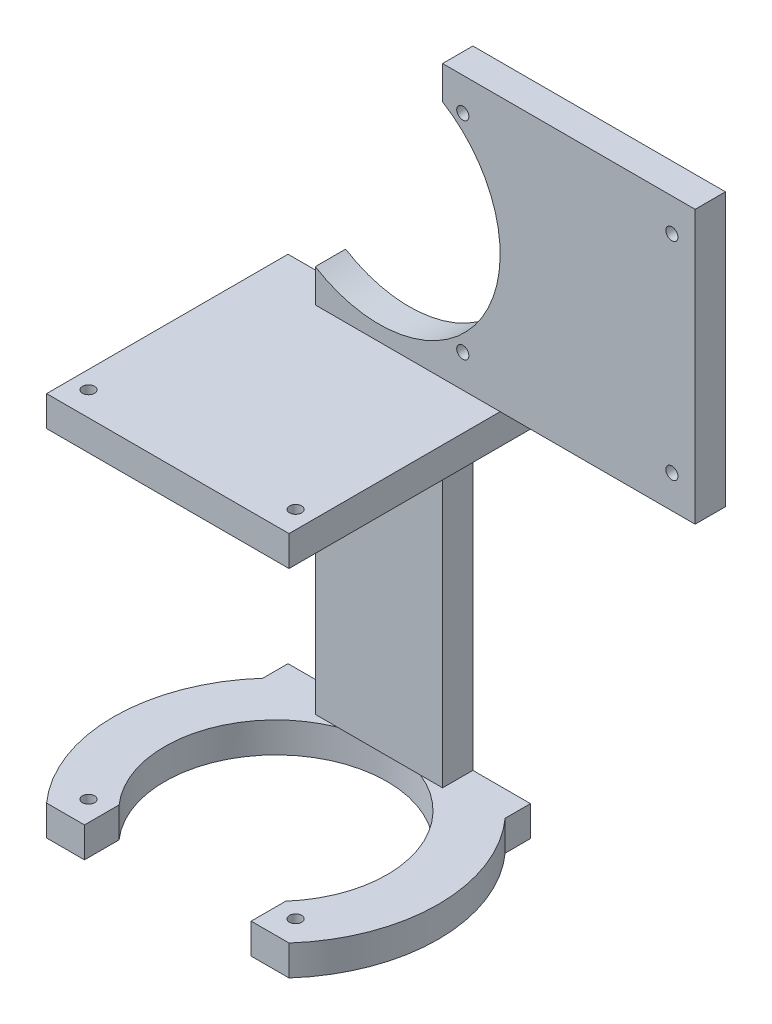
from build123d import *

# Parameters (mm, degrees)
SKETCH_1_W                      = 25
SKETCH_1_H                      = 27
EXTRUDE_1_DEPTH                 = 3
CUT_EXTRUDE_1_REACH             = 38.919
SKETCH_2_R                      = 0.6
SKETCH_2_R_2                    = 12
CUT_EXTRUDE_1_DIRECTION_2_DEPTH = 37.918829884
EXTRUDE_2_DEPTH                 = 3
SKETCH_4_W                      = 24
SKETCH_4_H                      = 3
EXTRUDE_3_DEPTH                 = 20.9
EXTRUDE_3_DIRECTION_2_REACH     = 47.668
CUT_EXTRUDE_2_REACH             = 53.457
SKETCH_5_R                      = 0.6
CUT_EXTRUDE_2_DIRECTION_2_DEPTH = 52.456972317
CUT_EXTRUDE_4_DEPTH             = 3
EXTRUDE_4_DEPTH                 = 3


with BuildPart() as part:
    # 草图1 → 凸台-拉伸1 (new body)
    with BuildSketch(Plane.XY):
        with Locations((12.5, 13.5)):
            Rectangle(SKETCH_1_W, SKETCH_1_H)
    extrude(amount=EXTRUDE_1_DEPTH)

    # 草图2 → 切除-拉伸1 (cut, up to next)
    with BuildSketch(Plane.XY.offset(3), mode=Mode.PRIVATE) as cut_extrude_1_sk1:
        with Locations(Location((2, 23.75, 0), (0, 0, 180))):
            Circle(SKETCH_2_R)
    cut_extrude_1_tool1 = extrude(cut_extrude_1_sk1.sketch, amount=-CUT_EXTRUDE_1_REACH, mode=Mode.PRIVATE) & part.part
    # 草图2 → 切除-拉伸1 (cut, up to next)
    with BuildSketch(Plane.XY.offset(3), mode=Mode.PRIVATE) as cut_extrude_1_sk2:
        with Locations(Location((22.7, 23.75, 0), (0, 0, 180))):
            Circle(SKETCH_2_R)
    cut_extrude_1_tool2 = extrude(cut_extrude_1_sk2.sketch, amount=-CUT_EXTRUDE_1_REACH, mode=Mode.PRIVATE) & part.part
    # 草图2 → 切除-拉伸1 (cut, up to next)
    with BuildSketch(Plane.XY.offset(3), mode=Mode.PRIVATE) as cut_extrude_1_sk3:
        with Locations(Location((22.7, 3.25, 0), (0, 0, 180))):
            Circle(SKETCH_2_R)
    cut_extrude_1_tool3 = extrude(cut_extrude_1_sk3.sketch, amount=-CUT_EXTRUDE_1_REACH, mode=Mode.PRIVATE) & part.part
    # 草图2 → 切除-拉伸1 (cut, up to next)
    with BuildSketch(Plane.XY.offset(3), mode=Mode.PRIVATE) as cut_extrude_1_sk4:
        with Locations(Location((2, 3.25, 0), (0, 0, 180))):
            Circle(SKETCH_2_R)
    cut_extrude_1_tool4 = extrude(cut_extrude_1_sk4.sketch, amount=-CUT_EXTRUDE_1_REACH, mode=Mode.PRIVATE) & part.part
    # 草图2 → 切除-拉伸1 (cut, up to next)
    with BuildSketch(Plane.XY.offset(3), mode=Mode.PRIVATE) as cut_extrude_1_sk5:
        with Locations((-6.3, 13.5)):
            Circle(SKETCH_2_R_2)
    cut_extrude_1_tool5 = extrude(cut_extrude_1_sk5.sketch, amount=-CUT_EXTRUDE_1_REACH, mode=Mode.PRIVATE) & part.part
    add(cut_extrude_1_tool1.solids().sort_by_distance((2, 23.75, 3))[0], mode=Mode.SUBTRACT)
    add(cut_extrude_1_tool2.solids().sort_by_distance((22.7, 23.75, 3))[0], mode=Mode.SUBTRACT)
    add(cut_extrude_1_tool3.solids().sort_by_distance((22.7, 3.25, 3))[0], mode=Mode.SUBTRACT)
    add(cut_extrude_1_tool4.solids().sort_by_distance((2, 3.25, 3))[0], mode=Mode.SUBTRACT)
    add(cut_extrude_1_tool5.solids().sort_by_distance((-6.3, 13.5, 3))[0], mode=Mode.SUBTRACT)

    # 草图2 → 切除-拉伸1 direction 2 (cut)
    with BuildSketch(Plane.XY.offset(3)):
        with Locations(Location((2, 23.75, 0), (0, 0, 180))):
            Circle(SKETCH_2_R)
        with Locations(Location((22.7, 23.75, 0), (0, 0, 180))):
            Circle(SKETCH_2_R)
        with Locations(Location((22.7, 3.25, 0), (0, 0, 180))):
            Circle(SKETCH_2_R)
        with Locations(Location((2, 3.25, 0), (0, 0, 180))):
            Circle(SKETCH_2_R)
        with Locations((-6.3, 13.5)):
            Circle(SKETCH_2_R_2)
    extrude(amount=CUT_EXTRUDE_1_DIRECTION_2_DEPTH, mode=Mode.SUBTRACT)

    # 草图3 → 凸台-拉伸2 (add)
    with BuildSketch(Plane.XY.offset(3)):
        with BuildLine():
            ThreePointArc((0, 3.286773282), (-3.025761204, 1.955331953), (-6.3, 1.5))
            Line((-6.3, 1.5), (-6.3, -38.1))
            Line((-6.3, -38.1), (0, -38.1))
            Line((0, -38.1), (0, 0))
            Line((0, 0), (0, 3.286773282))
        make_face()
        with BuildLine():
            Line((-6.3, -38.1), (-6.3, 1.5))
            ThreePointArc((-6.3, 1.5), (-9.574238796, 1.955331953), (-12.6, 3.286773282))
            Line((-12.6, 3.286773282), (-12.6, -38.1))
            Line((-12.6, -38.1), (-6.3, -38.1))
        make_face()
    extrude(amount=-EXTRUDE_2_DEPTH)

    # 草图4 → 凸台-拉伸3 (add)
    with BuildSketch(Plane.XY.offset(3)):
        with Locations((-6.3, -1.5)):
            Rectangle(SKETCH_4_W, SKETCH_4_H)
    extrude_3 = extrude(amount=EXTRUDE_3_DEPTH)

    # 凸台-拉伸3 direction 2: up to this face of the body (flat: up to its plane)
    extrude_3_direction_2_end = Plane(part.part.faces().sort_by_distance((6.451782548, 13.5, 0))[0])
    # 草图4 → 凸台-拉伸3 direction 2 (add, up to the picked face)
    with BuildSketch(Plane.XY.offset(3), mode=Mode.PRIVATE) as extrude_3_direction_2_sk1:
        with Locations((-6.3, -1.5)):
            Rectangle(SKETCH_4_W, SKETCH_4_H)
    extrude_3_direction_2_tool1 = split(extrude(extrude_3_direction_2_sk1.sketch, amount=-EXTRUDE_3_DIRECTION_2_REACH, mode=Mode.PRIVATE), bisect_by=extrude_3_direction_2_end, keep=Keep.BOTH, mode=Mode.PRIVATE)
    extrude_3_direction_2 = extrude_3_direction_2_tool1.solids().sort_by(Axis((-6.3, -1.5, 3), (0, 0, -1)))[0]
    add(extrude_3_direction_2)

    # 草图5 → 切除-拉伸2 (cut, up to next)
    with BuildSketch(Plane(origin=(0, 0, 0), x_dir=(1, 0, 0), z_dir=(0, 1, 0)), mode=Mode.PRIVATE) as cut_extrude_2_sk1:
        with Locations(Location((-16.55, -21.5, 0), (0, 0, 90))):
            Circle(SKETCH_5_R)
    cut_extrude_2_tool1 = extrude(cut_extrude_2_sk1.sketch, amount=-CUT_EXTRUDE_2_REACH, mode=Mode.PRIVATE) & part.part
    # 草图5 → 切除-拉伸2 (cut, up to next)
    with BuildSketch(Plane(origin=(0, 0, 0), x_dir=(1, 0, 0), z_dir=(0, 1, 0)), mode=Mode.PRIVATE) as cut_extrude_2_sk2:
        with Locations(Location((3.95, -21.5, 0), (0, 0, 90))):
            Circle(SKETCH_5_R)
    cut_extrude_2_tool2 = extrude(cut_extrude_2_sk2.sketch, amount=-CUT_EXTRUDE_2_REACH, mode=Mode.PRIVATE) & part.part
    cut_extrude_2_1 = cut_extrude_2_tool1.solids().sort_by_distance((-16.55, 0, 21.5))[0]
    add(cut_extrude_2_1, mode=Mode.SUBTRACT)
    cut_extrude_2_2 = cut_extrude_2_tool2.solids().sort_by_distance((3.95, 0, 21.5))[0]
    add(cut_extrude_2_2, mode=Mode.SUBTRACT)
    cut_extrude_2 = cut_extrude_2_1 + cut_extrude_2_2  # 切除-拉伸2 as one shape, for the pattern or mirror that repeats it

    # 草图5 → 切除-拉伸2 direction 2 (cut)
    with BuildSketch(Plane(origin=(0, 0, 0), x_dir=(1, 0, 0), z_dir=(0, 1, 0))):
        with Locations(Location((-16.55, -21.5, 0), (0, 0, 90))):
            Circle(SKETCH_5_R)
        with Locations(Location((3.95, -21.5, 0), (0, 0, 90))):
            Circle(SKETCH_5_R)
    cut_extrude_2_direction_2 = extrude(amount=CUT_EXTRUDE_2_DIRECTION_2_DEPTH, mode=Mode.SUBTRACT)

    # 镜向3: 凸台-拉伸3, 凸台-拉伸3 direction 2, 切除-拉伸2, 切除-拉伸2 direction 2 across plane
    add(extrude_3.mirror(Plane(origin=(0, -19.05, 0), x_dir=(0, 0, 1), z_dir=(0, -1, 0))))
    add(extrude_3_direction_2.mirror(Plane(origin=(0, -19.05, 0), x_dir=(0, 0, 1), z_dir=(0, -1, 0))))
    add(cut_extrude_2.mirror(Plane(origin=(0, -19.05, 0), x_dir=(0, 0, 1), z_dir=(0, -1, 0))), mode=Mode.SUBTRACT)
    add(cut_extrude_2_direction_2.mirror(Plane(origin=(0, -19.05, 0), x_dir=(0, 0, 1), z_dir=(0, -1, 0))), mode=Mode.SUBTRACT)

    # 草图9 → 切除-拉伸4 (cut)
    with BuildSketch(Plane.XZ.offset(38.1)):
        with BuildLine():
            ThreePointArc((-8.851470164, 23.9), (-11.965615436, 22.628722169), (-14.55, 20.475816105))
            ThreePointArc((-14.55, 20.475816105), (-10.189087297, 2.910442186), (4.7, 13.2))
            ThreePointArc((4.7, 13.2), (3.989557814, 17.089087297), (1.95, 20.475816105))
            ThreePointArc((1.95, 20.475816105), (-0.634384564, 22.628722169), (-3.748529836, 23.9))
            Line((-3.748529836, 23.9), (-8.851470164, 23.9))
        make_face()
        with BuildLine():
            ThreePointArc((-3.748529836, 23.9), (-6.3, 24.2), (-8.851470164, 23.9))
            Line((-8.851470164, 23.9), (-3.748529836, 23.9))
        make_face()
        with BuildLine():
            Line((-8.851470164, 23.9), (-14.55, 23.9))
            Line((-14.55, 23.9), (-14.55, 20.475816105))
            ThreePointArc((-14.55, 20.475816105), (-11.965615436, 22.628722169), (-8.851470164, 23.9))
        make_face()
        with BuildLine():
            Line((1.95, 23.9), (-3.748529836, 23.9))
            ThreePointArc((-3.748529836, 23.9), (-0.634384564, 22.628722169), (1.95, 20.475816105))
            Line((1.95, 20.475816105), (1.95, 23.9))
        make_face()
    extrude(amount=-CUT_EXTRUDE_4_DEPTH, mode=Mode.SUBTRACT)

    # 草图10 → 凸台-拉伸4 (add)
    with BuildSketch(Plane.XZ.offset(38.1)):
        with BuildLine():
            ThreePointArc((-18.3, 23.9), (-22.377624203, 13.2), (-18.3, 2.5))
            Line((-18.3, 2.5), (-18.3, 23.9))
        make_face()
        with BuildLine():
            Line((5.7, 23.9), (5.7, 2.5))
            ThreePointArc((5.7, 2.5), (8.723672827, 7.474682997), (9.777624203, 13.2))
            ThreePointArc((9.777624203, 13.2), (8.723672827, 18.925317003), (5.7, 23.9))
        make_face()
    extrude(amount=-EXTRUDE_4_DEPTH)


solid = part.part
